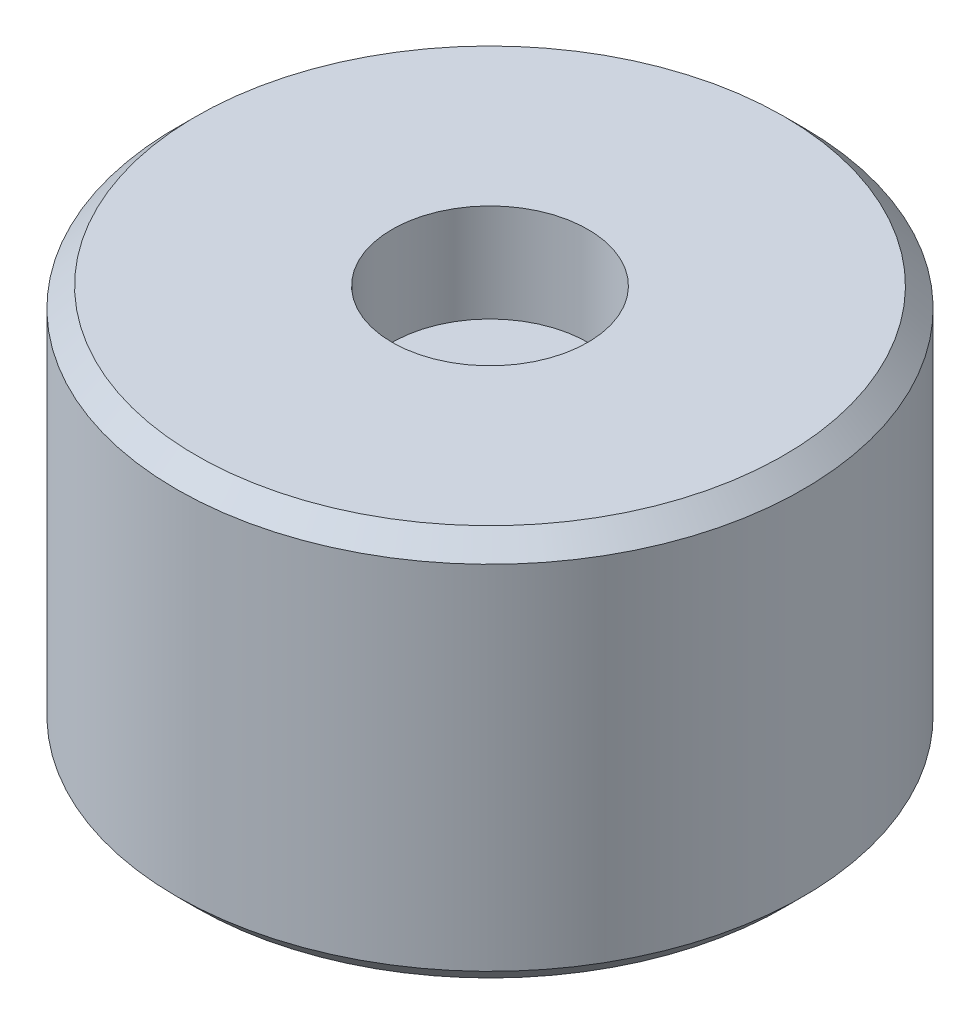
from build123d import *

# Parameters (mm, degrees)
SKETCH1_R           = 3.2
BOSS_EXTRUDE1_DEPTH = 4
CHAMFER1_SIZE       = 0.2
SKETCH2_R           = 1
CUT_EXTRUDE1_DEPTH  = 1
SKETCH3_R           = 2.8
CUT_EXTRUDE2_DEPTH  = 0.2


with BuildPart() as part:
    # Sketch1 → Boss-Extrude1 (new body)
    with BuildSketch(Plane(origin=(0, 0, 0), x_dir=(1, 0, 0), z_dir=(0, 1, 0))):
        Circle(SKETCH1_R)
    extrude(amount=BOSS_EXTRUDE1_DEPTH)

    # Chamfer1
    chamfer1_edges = [part.edges().sort_by_distance(p)[0] for p in [
        (-3.2, 0, 0),
        (-3.2, 4, 0),
    ]]
    chamfer(chamfer1_edges, length=CHAMFER1_SIZE)

    # Sketch2 → Cut-Extrude1 (cut)
    with BuildSketch(Plane(origin=(0, 4, 0), x_dir=(1, 0, 0), z_dir=(0, 1, 0))):
        Circle(SKETCH2_R)
    extrude(amount=-CUT_EXTRUDE1_DEPTH, mode=Mode.SUBTRACT)

    # Sketch3 → Cut-Extrude2 (cut)
    with BuildSketch(Plane.XZ):
        Circle(SKETCH3_R)
        with BuildLine():
            Line((0.635, -1.386506401), (0.635, 1.386506401))
            ThreePointArc((0.635, 1.386506401), (1.525, 0), (0.635, -1.386506401))
        make_face(mode=Mode.SUBTRACT)
        with BuildLine():
            ThreePointArc((-0.635, -1.386506401), (-1.525, 0), (-0.635, 1.386506401))
            Line((-0.635, 1.386506401), (-0.635, -1.386506401))
        make_face(mode=Mode.SUBTRACT)
    extrude(amount=-CUT_EXTRUDE2_DEPTH, mode=Mode.SUBTRACT)


solid = part.part
